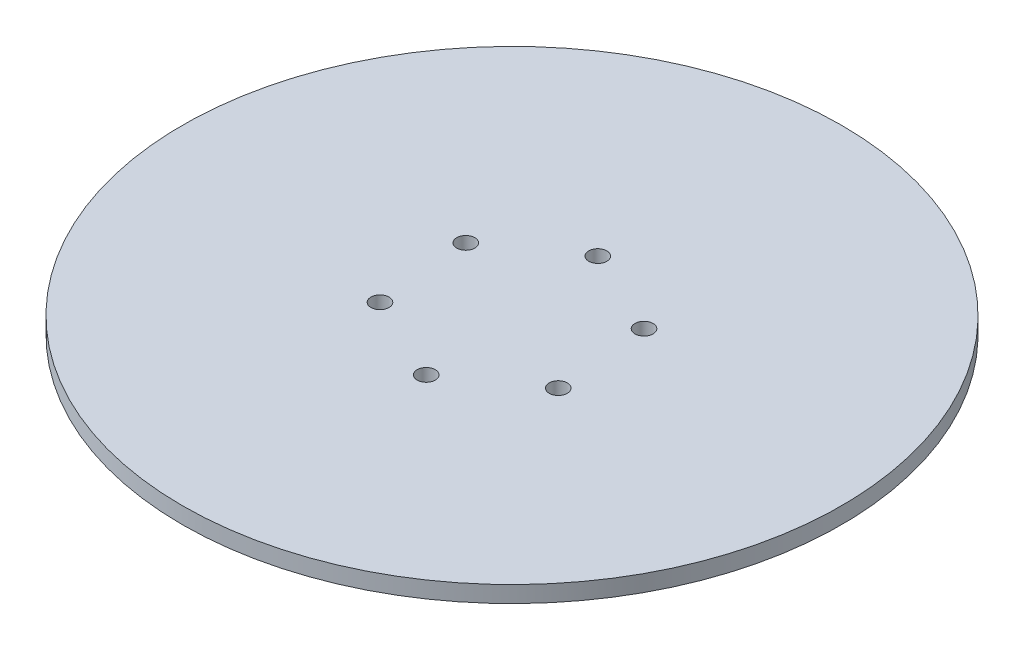
from build123d import *

# Parameters (mm, degrees)
SKETCH_2_R          = 60
EXTRUDE_1_DEPTH     = 3
CUT_EXTRUDE_1_DEPTH = 10


with BuildPart() as part:
    # 草图2 → 凸台-拉伸1 (new body)
    with BuildSketch(Plane(origin=(0, 0, 0), x_dir=(1, 0, 0), z_dir=(0, 1, 0))):
        with Locations(Location((0, 0, 0), (0, 0, 270))):
            Circle(SKETCH_2_R)
    extrude(amount=EXTRUDE_1_DEPTH)

    # 草图3 → 切除-拉伸1 (cut)
    with BuildSketch(Plane.XZ):
        with BuildLine():
            ThreePointArc((17.005273727, 6.290323162), (16.607301875, 8.589587915), (14.308037122, 8.191616063))
            ThreePointArc((14.308037122, 8.191616063), (14.706008974, 5.89235131), (17.005273727, 6.290323162))
        make_face()
        with BuildLine():
            ThreePointArc((15.447809647, -10.88922298), (15.049837795, -8.589958227), (12.750573042, -8.987930079))
            ThreePointArc((12.750573042, -8.987930079), (13.148544894, -11.287194832), (15.447809647, -10.88922298))
        make_face()
        with BuildLine():
            ThreePointArc((-0.208845777, -18.130192593), (-0.606817629, -15.830927839), (-2.906082382, -16.228899691))
            ThreePointArc((-2.906082382, -16.228899691), (-2.50811053, -18.528164444), (-0.208845777, -18.130192593))
        make_face()
        with BuildLine():
            ThreePointArc((-14.308037122, -8.191616063), (-14.706008974, -5.89235131), (-17.005273727, -6.290323162))
            ThreePointArc((-17.005273727, -6.290323162), (-16.607301875, -8.589587915), (-14.308037122, -8.191616063))
        make_face()
        with BuildLine():
            ThreePointArc((-12.750573042, 8.987930079), (-13.148544894, 11.287194832), (-15.447809647, 10.88922298))
            ThreePointArc((-15.447809647, 10.88922298), (-15.049837795, 8.589958227), (-12.750573042, 8.987930079))
        make_face()
        with BuildLine():
            ThreePointArc((2.906082382, 16.228899691), (2.50811053, 18.528164444), (0.208845777, 18.130192593))
            ThreePointArc((0.208845777, 18.130192593), (0.606817629, 15.830927839), (2.906082382, 16.228899691))
        make_face()
    extrude(amount=-CUT_EXTRUDE_1_DEPTH, mode=Mode.SUBTRACT)


solid = part.part
